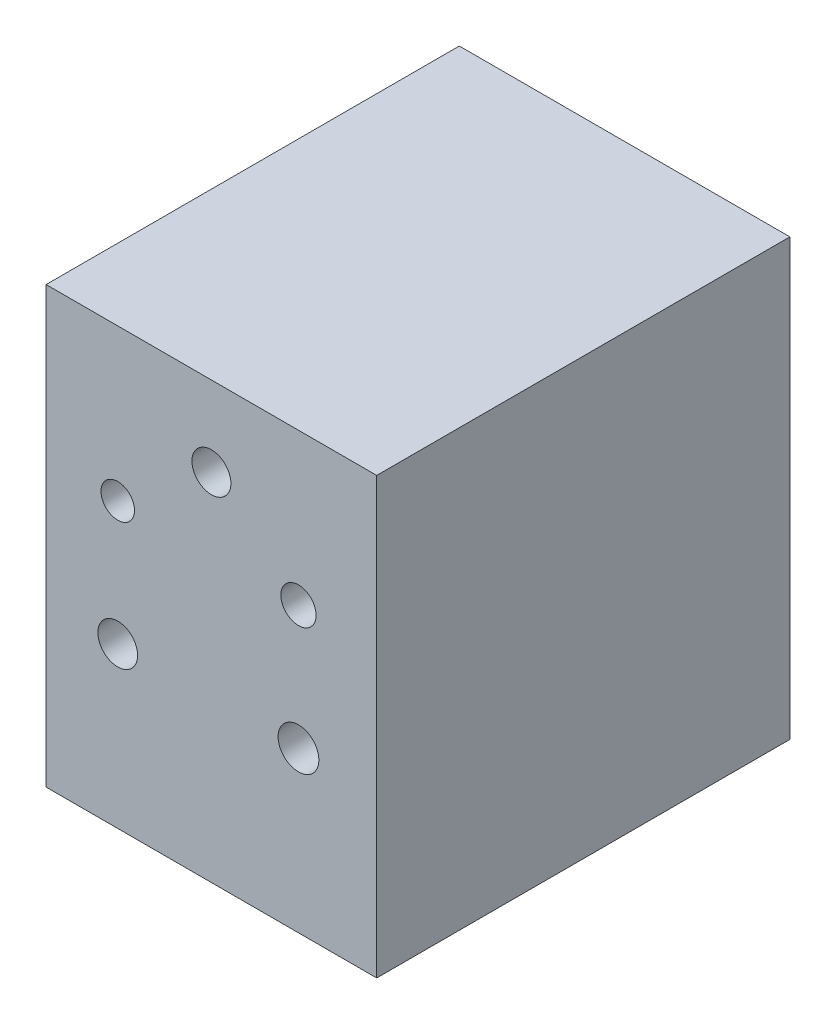
from build123d import *

# Parameters (mm, degrees)
SKETCH3_W           = 92.013237226
SKETCH3_H           = 121.150833856
SKETCH3_R           = 5.4219352
SKETCH3_R_2         = 4.664125017
SKETCH3_R_3         = 4.907361247
SKETCH3_R_4         = 5.529310678
SKETCH3_R_5         = 5.674138676
BOSS_EXTRUDE2_DEPTH = 115


with BuildPart() as part:
    # Sketch3 → Boss-Extrude2 (new body)
    with BuildSketch(Plane.XY):
        with Locations((73.994021944, 35.65515047)):
            Rectangle(SKETCH3_W, SKETCH3_H)
        with Locations((73.994021944, 73.994021944)):
            Circle(SKETCH3_R, mode=Mode.SUBTRACT)
        with Locations((47.923589342, 54.057808777)):
            Circle(SKETCH3_R_2, mode=Mode.SUBTRACT)
        with Locations((98.224203016, 54.057808777)):
            Circle(SKETCH3_R_3, mode=Mode.SUBTRACT)
        with Locations((47.923589342, 19.552824451)):
            Circle(SKETCH3_R_4, mode=Mode.SUBTRACT)
        with Locations((98.224203016, 19.552824451)):
            Circle(SKETCH3_R_5, mode=Mode.SUBTRACT)
    extrude(amount=BOSS_EXTRUDE2_DEPTH)


solid = part.part
